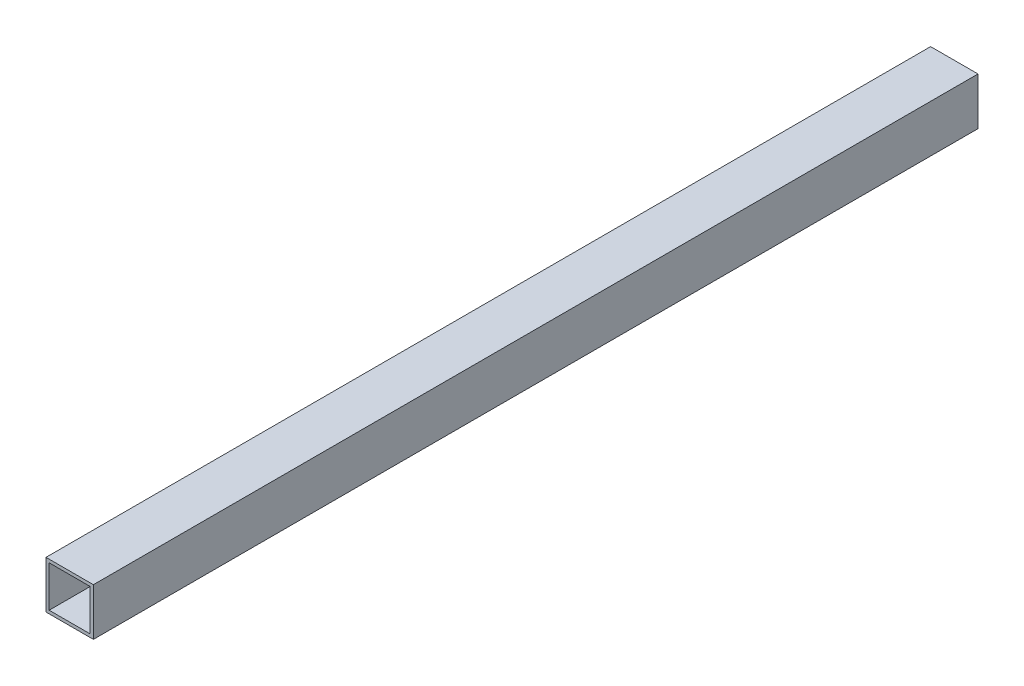
from build123d import *

# Parameters (mm, degrees)
SKETCH1_W           = 15
SKETCH1_H           = 15
SKETCH1_W_2         = 13
SKETCH1_H_2         = 13
BOSS_EXTRUDE1_DEPTH = 280


with BuildPart() as part:
    # Sketch1 → Boss-Extrude1 (new body)
    with BuildSketch(Plane.XY):
        Rectangle(SKETCH1_W, SKETCH1_H)
        Rectangle(SKETCH1_W_2, SKETCH1_H_2, mode=Mode.SUBTRACT)
    extrude(amount=BOSS_EXTRUDE1_DEPTH)


solid = part.part
